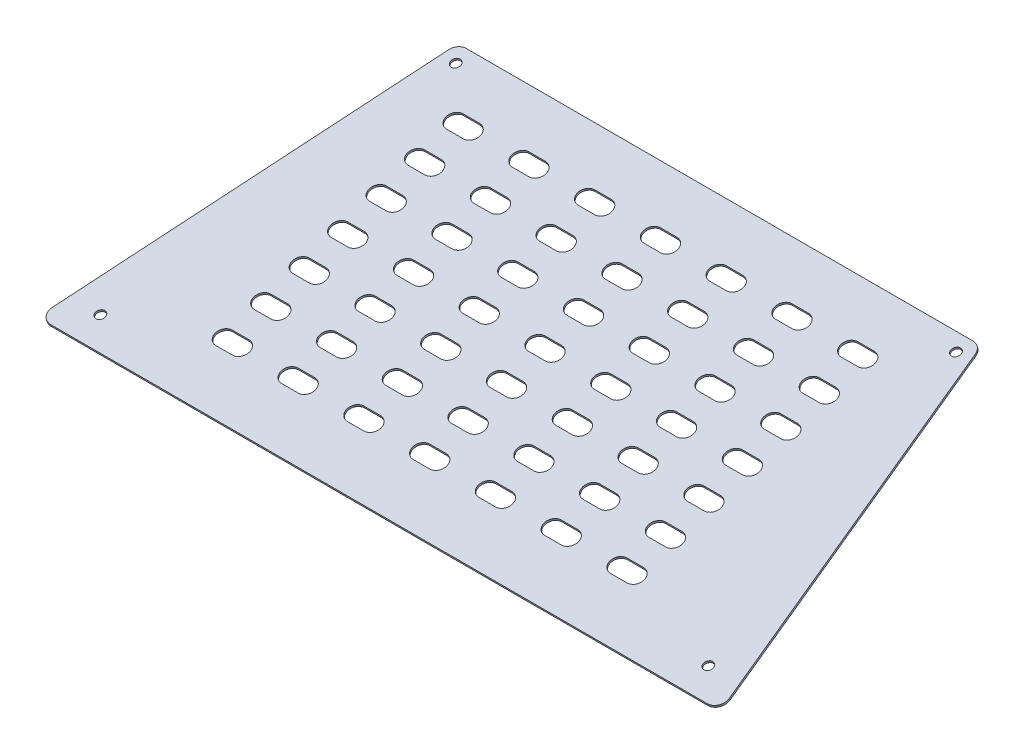
from build123d import *

# Parameters (mm, degrees)
BOSS_EXTRUDE1_START = 1
SKETCH2_R           = 2.25
BOSS_EXTRUDE1_DEPTH = 1
CUT_EXTRUDE1_DEPTH  = 1


with BuildPart() as part:
    # Sketch2 → Boss-Extrude1 (new body)
    with BuildSketch(Plane(origin=(0, 394.173712529, 122.85933897), x_dir=(1, 0, 0), z_dir=(0, 0.954700334487347, 0.2975689354246304)).offset(BOSS_EXTRUDE1_START)):
        with BuildLine():
            Line((-128.178393634, 873.415697526), (-164.692944748, 709.781747011))
            ThreePointArc((-164.692944748, 709.781747011), (-163.71455594, 705.565874018), (-159.812967812, 703.692791042))
            Line((-159.812967812, 703.692791042), (159.812967812, 703.692791042))
            ThreePointArc((159.812967812, 703.692791042), (163.71455594, 705.565874018), (164.692944748, 709.781747011))
            Line((164.692944748, 709.781747011), (128.178393634, 873.415697526))
            ThreePointArc((128.178393634, 873.415697526), (126.425333722, 876.228329685), (123.298416698, 877.326741556))
            Line((123.298416698, 877.326741556), (-123.298416698, 877.326741556))
            ThreePointArc((-123.298416698, 877.326741556), (-126.425333722, 876.228329685), (-128.178393634, 873.415697526))
        make_face()
        with Locations(Location((-121.695522225, 870.326741556, 0), (0, 0, 90))):
            Circle(SKETCH2_R, mode=Mode.SUBTRACT)
        with Locations(Location((121.695522225, 870.326741556, 0), (0, 0, 90))):
            Circle(SKETCH2_R, mode=Mode.SUBTRACT)
        with Locations(Location((147.891037223, 716.692791042, 0), (0, 0, 90))):
            Circle(SKETCH2_R, mode=Mode.SUBTRACT)
        with Locations(Location((-147.891037223, 716.692791042, 0), (0, 0, 90))):
            Circle(SKETCH2_R, mode=Mode.SUBTRACT)
    extrude(amount=BOSS_EXTRUDE1_DEPTH)

    # Sketch3 → Cut-Extrude1 (cut)
    with BuildSketch(Plane(origin=(0, 396.083113198, 123.454476841), x_dir=(1, 0, 0), z_dir=(0, 0.954700334487347, 0.2975689354246304))):
        with BuildLine():
            Line((-103.188534798, 854.726741556), (-95.188534798, 854.726741556))
            ThreePointArc((-95.188534798, 854.726741556), (-90.988534798, 850.526741556), (-95.188534798, 846.326741556))
            Line((-95.188534798, 846.326741556), (-103.188534798, 846.326741556))
            ThreePointArc((-103.188534798, 846.326741556), (-107.388534798, 850.526741556), (-103.188534798, 854.726741556))
        make_face()
        with BuildLine():
            Line((-71.188534798, 854.726741556), (-63.188534798, 854.726741556))
            ThreePointArc((-63.188534798, 854.726741556), (-58.988534798, 850.526741556), (-63.188534798, 846.326741556))
            Line((-63.188534798, 846.326741556), (-71.188534798, 846.326741556))
            ThreePointArc((-71.188534798, 846.326741556), (-75.388534798, 850.526741556), (-71.188534798, 854.726741556))
        make_face()
        with BuildLine():
            Line((-39.188534798, 854.726741556), (-31.188534798, 854.726741556))
            ThreePointArc((-31.188534798, 854.726741556), (-26.988534798, 850.526741556), (-31.188534798, 846.326741556))
            Line((-31.188534798, 846.326741556), (-39.188534798, 846.326741556))
            ThreePointArc((-39.188534798, 846.326741556), (-43.388534798, 850.526741556), (-39.188534798, 854.726741556))
        make_face()
        with BuildLine():
            Line((-7.188534798, 854.726741556), (0.811465202, 854.726741556))
            ThreePointArc((0.811465202, 854.726741556), (5.011465202, 850.526741556), (0.811465202, 846.326741556))
            Line((0.811465202, 846.326741556), (-7.188534798, 846.326741556))
            ThreePointArc((-7.188534798, 846.326741556), (-11.388534798, 850.526741556), (-7.188534798, 854.726741556))
        make_face()
        with BuildLine():
            Line((24.811465202, 854.726741556), (32.811465202, 854.726741556))
            ThreePointArc((32.811465202, 854.726741556), (37.011465202, 850.526741556), (32.811465202, 846.326741556))
            Line((32.811465202, 846.326741556), (24.811465202, 846.326741556))
            ThreePointArc((24.811465202, 846.326741556), (20.611465202, 850.526741556), (24.811465202, 854.726741556))
        make_face()
        with BuildLine():
            Line((56.811465202, 854.726741556), (64.811465202, 854.726741556))
            ThreePointArc((64.811465202, 854.726741556), (69.011465202, 850.526741556), (64.811465202, 846.326741556))
            Line((64.811465202, 846.326741556), (56.811465202, 846.326741556))
            ThreePointArc((56.811465202, 846.326741556), (52.611465202, 850.526741556), (56.811465202, 854.726741556))
        make_face()
        with BuildLine():
            Line((88.811465202, 854.726741556), (96.811465202, 854.726741556))
            ThreePointArc((96.811465202, 854.726741556), (101.011465202, 850.526741556), (96.811465202, 846.326741556))
            Line((96.811465202, 846.326741556), (88.811465202, 846.326741556))
            ThreePointArc((88.811465202, 846.326741556), (84.611465202, 850.526741556), (88.811465202, 854.726741556))
        make_face()
        with BuildLine():
            Line((-71.188534798, 835.126741556), (-63.188534798, 835.126741556))
            ThreePointArc((-63.188534798, 835.126741556), (-58.988534798, 830.926741556), (-63.188534798, 826.726741556))
            Line((-63.188534798, 826.726741556), (-71.188534798, 826.726741556))
            ThreePointArc((-71.188534798, 826.726741556), (-75.388534798, 830.926741556), (-71.188534798, 835.126741556))
        make_face()
        with BuildLine():
            Line((-39.188534798, 835.126741556), (-31.188534798, 835.126741556))
            ThreePointArc((-31.188534798, 835.126741556), (-26.988534798, 830.926741556), (-31.188534798, 826.726741556))
            Line((-31.188534798, 826.726741556), (-39.188534798, 826.726741556))
            ThreePointArc((-39.188534798, 826.726741556), (-43.388534798, 830.926741556), (-39.188534798, 835.126741556))
        make_face()
        with BuildLine():
            Line((-7.188534798, 835.126741556), (0.811465202, 835.126741556))
            ThreePointArc((0.811465202, 835.126741556), (5.011465202, 830.926741556), (0.811465202, 826.726741556))
            Line((0.811465202, 826.726741556), (-7.188534798, 826.726741556))
            ThreePointArc((-7.188534798, 826.726741556), (-11.388534798, 830.926741556), (-7.188534798, 835.126741556))
        make_face()
        with BuildLine():
            Line((24.811465202, 835.126741556), (32.811465202, 835.126741556))
            ThreePointArc((32.811465202, 835.126741556), (37.011465202, 830.926741556), (32.811465202, 826.726741556))
            Line((32.811465202, 826.726741556), (24.811465202, 826.726741556))
            ThreePointArc((24.811465202, 826.726741556), (20.611465202, 830.926741556), (24.811465202, 835.126741556))
        make_face()
        with BuildLine():
            Line((56.811465202, 835.126741556), (64.811465202, 835.126741556))
            ThreePointArc((64.811465202, 835.126741556), (69.011465202, 830.926741556), (64.811465202, 826.726741556))
            Line((64.811465202, 826.726741556), (56.811465202, 826.726741556))
            ThreePointArc((56.811465202, 826.726741556), (52.611465202, 830.926741556), (56.811465202, 835.126741556))
        make_face()
        with BuildLine():
            Line((88.811465202, 835.126741556), (96.811465202, 835.126741556))
            ThreePointArc((96.811465202, 835.126741556), (101.011465202, 830.926741556), (96.811465202, 826.726741556))
            Line((96.811465202, 826.726741556), (88.811465202, 826.726741556))
            ThreePointArc((88.811465202, 826.726741556), (84.611465202, 830.926741556), (88.811465202, 835.126741556))
        make_face()
        with BuildLine():
            Line((-71.188534798, 815.526741556), (-63.188534798, 815.526741556))
            ThreePointArc((-63.188534798, 815.526741556), (-58.988534798, 811.326741556), (-63.188534798, 807.126741556))
            Line((-63.188534798, 807.126741556), (-71.188534798, 807.126741556))
            ThreePointArc((-71.188534798, 807.126741556), (-75.388534798, 811.326741556), (-71.188534798, 815.526741556))
        make_face()
        with BuildLine():
            Line((-39.188534798, 815.526741556), (-31.188534798, 815.526741556))
            ThreePointArc((-31.188534798, 815.526741556), (-26.988534798, 811.326741556), (-31.188534798, 807.126741556))
            Line((-31.188534798, 807.126741556), (-39.188534798, 807.126741556))
            ThreePointArc((-39.188534798, 807.126741556), (-43.388534798, 811.326741556), (-39.188534798, 815.526741556))
        make_face()
        with BuildLine():
            Line((-7.188534798, 815.526741556), (0.811465202, 815.526741556))
            ThreePointArc((0.811465202, 815.526741556), (5.011465202, 811.326741556), (0.811465202, 807.126741556))
            Line((0.811465202, 807.126741556), (-7.188534798, 807.126741556))
            ThreePointArc((-7.188534798, 807.126741556), (-11.388534798, 811.326741556), (-7.188534798, 815.526741556))
        make_face()
        with BuildLine():
            Line((24.811465202, 815.526741556), (32.811465202, 815.526741556))
            ThreePointArc((32.811465202, 815.526741556), (37.011465202, 811.326741556), (32.811465202, 807.126741556))
            Line((32.811465202, 807.126741556), (24.811465202, 807.126741556))
            ThreePointArc((24.811465202, 807.126741556), (20.611465202, 811.326741556), (24.811465202, 815.526741556))
        make_face()
        with BuildLine():
            Line((56.811465202, 815.526741556), (64.811465202, 815.526741556))
            ThreePointArc((64.811465202, 815.526741556), (69.011465202, 811.326741556), (64.811465202, 807.126741556))
            Line((64.811465202, 807.126741556), (56.811465202, 807.126741556))
            ThreePointArc((56.811465202, 807.126741556), (52.611465202, 811.326741556), (56.811465202, 815.526741556))
        make_face()
        with BuildLine():
            Line((88.811465202, 815.526741556), (96.811465202, 815.526741556))
            ThreePointArc((96.811465202, 815.526741556), (101.011465202, 811.326741556), (96.811465202, 807.126741556))
            Line((96.811465202, 807.126741556), (88.811465202, 807.126741556))
            ThreePointArc((88.811465202, 807.126741556), (84.611465202, 811.326741556), (88.811465202, 815.526741556))
        make_face()
        with BuildLine():
            Line((-71.188534798, 795.926741556), (-63.188534798, 795.926741556))
            ThreePointArc((-63.188534798, 795.926741556), (-58.988534798, 791.726741556), (-63.188534798, 787.526741556))
            Line((-63.188534798, 787.526741556), (-71.188534798, 787.526741556))
            ThreePointArc((-71.188534798, 787.526741556), (-75.388534798, 791.726741556), (-71.188534798, 795.926741556))
        make_face()
        with BuildLine():
            Line((-39.188534798, 795.926741556), (-31.188534798, 795.926741556))
            ThreePointArc((-31.188534798, 795.926741556), (-26.988534798, 791.726741556), (-31.188534798, 787.526741556))
            Line((-31.188534798, 787.526741556), (-39.188534798, 787.526741556))
            ThreePointArc((-39.188534798, 787.526741556), (-43.388534798, 791.726741556), (-39.188534798, 795.926741556))
        make_face()
        with BuildLine():
            Line((-7.188534798, 795.926741556), (0.811465202, 795.926741556))
            ThreePointArc((0.811465202, 795.926741556), (5.011465202, 791.726741556), (0.811465202, 787.526741556))
            Line((0.811465202, 787.526741556), (-7.188534798, 787.526741556))
            ThreePointArc((-7.188534798, 787.526741556), (-11.388534798, 791.726741556), (-7.188534798, 795.926741556))
        make_face()
        with BuildLine():
            Line((24.811465202, 795.926741556), (32.811465202, 795.926741556))
            ThreePointArc((32.811465202, 795.926741556), (37.011465202, 791.726741556), (32.811465202, 787.526741556))
            Line((32.811465202, 787.526741556), (24.811465202, 787.526741556))
            ThreePointArc((24.811465202, 787.526741556), (20.611465202, 791.726741556), (24.811465202, 795.926741556))
        make_face()
        with BuildLine():
            Line((56.811465202, 795.926741556), (64.811465202, 795.926741556))
            ThreePointArc((64.811465202, 795.926741556), (69.011465202, 791.726741556), (64.811465202, 787.526741556))
            Line((64.811465202, 787.526741556), (56.811465202, 787.526741556))
            ThreePointArc((56.811465202, 787.526741556), (52.611465202, 791.726741556), (56.811465202, 795.926741556))
        make_face()
        with BuildLine():
            Line((88.811465202, 795.926741556), (96.811465202, 795.926741556))
            ThreePointArc((96.811465202, 795.926741556), (101.011465202, 791.726741556), (96.811465202, 787.526741556))
            Line((96.811465202, 787.526741556), (88.811465202, 787.526741556))
            ThreePointArc((88.811465202, 787.526741556), (84.611465202, 791.726741556), (88.811465202, 795.926741556))
        make_face()
        with BuildLine():
            Line((-71.188534798, 776.326741556), (-63.188534798, 776.326741556))
            ThreePointArc((-63.188534798, 776.326741556), (-58.988534798, 772.126741556), (-63.188534798, 767.926741556))
            Line((-63.188534798, 767.926741556), (-71.188534798, 767.926741556))
            ThreePointArc((-71.188534798, 767.926741556), (-75.388534798, 772.126741556), (-71.188534798, 776.326741556))
        make_face()
        with BuildLine():
            Line((-39.188534798, 776.326741556), (-31.188534798, 776.326741556))
            ThreePointArc((-31.188534798, 776.326741556), (-26.988534798, 772.126741556), (-31.188534798, 767.926741556))
            Line((-31.188534798, 767.926741556), (-39.188534798, 767.926741556))
            ThreePointArc((-39.188534798, 767.926741556), (-43.388534798, 772.126741556), (-39.188534798, 776.326741556))
        make_face()
        with BuildLine():
            Line((-7.188534798, 776.326741556), (0.811465202, 776.326741556))
            ThreePointArc((0.811465202, 776.326741556), (5.011465202, 772.126741556), (0.811465202, 767.926741556))
            Line((0.811465202, 767.926741556), (-7.188534798, 767.926741556))
            ThreePointArc((-7.188534798, 767.926741556), (-11.388534798, 772.126741556), (-7.188534798, 776.326741556))
        make_face()
        with BuildLine():
            Line((24.811465202, 776.326741556), (32.811465202, 776.326741556))
            ThreePointArc((32.811465202, 776.326741556), (37.011465202, 772.126741556), (32.811465202, 767.926741556))
            Line((32.811465202, 767.926741556), (24.811465202, 767.926741556))
            ThreePointArc((24.811465202, 767.926741556), (20.611465202, 772.126741556), (24.811465202, 776.326741556))
        make_face()
        with BuildLine():
            Line((56.811465202, 776.326741556), (64.811465202, 776.326741556))
            ThreePointArc((64.811465202, 776.326741556), (69.011465202, 772.126741556), (64.811465202, 767.926741556))
            Line((64.811465202, 767.926741556), (56.811465202, 767.926741556))
            ThreePointArc((56.811465202, 767.926741556), (52.611465202, 772.126741556), (56.811465202, 776.326741556))
        make_face()
        with BuildLine():
            Line((88.811465202, 776.326741556), (96.811465202, 776.326741556))
            ThreePointArc((96.811465202, 776.326741556), (101.011465202, 772.126741556), (96.811465202, 767.926741556))
            Line((96.811465202, 767.926741556), (88.811465202, 767.926741556))
            ThreePointArc((88.811465202, 767.926741556), (84.611465202, 772.126741556), (88.811465202, 776.326741556))
        make_face()
        with BuildLine():
            Line((-71.188534798, 756.726741556), (-63.188534798, 756.726741556))
            ThreePointArc((-63.188534798, 756.726741556), (-58.988534798, 752.526741556), (-63.188534798, 748.326741556))
            Line((-63.188534798, 748.326741556), (-71.188534798, 748.326741556))
            ThreePointArc((-71.188534798, 748.326741556), (-75.388534798, 752.526741556), (-71.188534798, 756.726741556))
        make_face()
        with BuildLine():
            Line((-39.188534798, 756.726741556), (-31.188534798, 756.726741556))
            ThreePointArc((-31.188534798, 756.726741556), (-26.988534798, 752.526741556), (-31.188534798, 748.326741556))
            Line((-31.188534798, 748.326741556), (-39.188534798, 748.326741556))
            ThreePointArc((-39.188534798, 748.326741556), (-43.388534798, 752.526741556), (-39.188534798, 756.726741556))
        make_face()
        with BuildLine():
            Line((-7.188534798, 756.726741556), (0.811465202, 756.726741556))
            ThreePointArc((0.811465202, 756.726741556), (5.011465202, 752.526741556), (0.811465202, 748.326741556))
            Line((0.811465202, 748.326741556), (-7.188534798, 748.326741556))
            ThreePointArc((-7.188534798, 748.326741556), (-11.388534798, 752.526741556), (-7.188534798, 756.726741556))
        make_face()
        with BuildLine():
            Line((24.811465202, 756.726741556), (32.811465202, 756.726741556))
            ThreePointArc((32.811465202, 756.726741556), (37.011465202, 752.526741556), (32.811465202, 748.326741556))
            Line((32.811465202, 748.326741556), (24.811465202, 748.326741556))
            ThreePointArc((24.811465202, 748.326741556), (20.611465202, 752.526741556), (24.811465202, 756.726741556))
        make_face()
        with BuildLine():
            Line((56.811465202, 756.726741556), (64.811465202, 756.726741556))
            ThreePointArc((64.811465202, 756.726741556), (69.011465202, 752.526741556), (64.811465202, 748.326741556))
            Line((64.811465202, 748.326741556), (56.811465202, 748.326741556))
            ThreePointArc((56.811465202, 748.326741556), (52.611465202, 752.526741556), (56.811465202, 756.726741556))
        make_face()
        with BuildLine():
            Line((88.811465202, 756.726741556), (96.811465202, 756.726741556))
            ThreePointArc((96.811465202, 756.726741556), (101.011465202, 752.526741556), (96.811465202, 748.326741556))
            Line((96.811465202, 748.326741556), (88.811465202, 748.326741556))
            ThreePointArc((88.811465202, 748.326741556), (84.611465202, 752.526741556), (88.811465202, 756.726741556))
        make_face()
        with BuildLine():
            Line((-71.188534798, 737.126741556), (-63.188534798, 737.126741556))
            ThreePointArc((-63.188534798, 737.126741556), (-58.988534798, 732.926741556), (-63.188534798, 728.726741556))
            Line((-63.188534798, 728.726741556), (-71.188534798, 728.726741556))
            ThreePointArc((-71.188534798, 728.726741556), (-75.388534798, 732.926741556), (-71.188534798, 737.126741556))
        make_face()
        with BuildLine():
            Line((-39.188534798, 737.126741556), (-31.188534798, 737.126741556))
            ThreePointArc((-31.188534798, 737.126741556), (-26.988534798, 732.926741556), (-31.188534798, 728.726741556))
            Line((-31.188534798, 728.726741556), (-39.188534798, 728.726741556))
            ThreePointArc((-39.188534798, 728.726741556), (-43.388534798, 732.926741556), (-39.188534798, 737.126741556))
        make_face()
        with BuildLine():
            Line((-7.188534798, 737.126741556), (0.811465202, 737.126741556))
            ThreePointArc((0.811465202, 737.126741556), (5.011465202, 732.926741556), (0.811465202, 728.726741556))
            Line((0.811465202, 728.726741556), (-7.188534798, 728.726741556))
            ThreePointArc((-7.188534798, 728.726741556), (-11.388534798, 732.926741556), (-7.188534798, 737.126741556))
        make_face()
        with BuildLine():
            Line((24.811465202, 737.126741556), (32.811465202, 737.126741556))
            ThreePointArc((32.811465202, 737.126741556), (37.011465202, 732.926741556), (32.811465202, 728.726741556))
            Line((32.811465202, 728.726741556), (24.811465202, 728.726741556))
            ThreePointArc((24.811465202, 728.726741556), (20.611465202, 732.926741556), (24.811465202, 737.126741556))
        make_face()
        with BuildLine():
            Line((56.811465202, 737.126741556), (64.811465202, 737.126741556))
            ThreePointArc((64.811465202, 737.126741556), (69.011465202, 732.926741556), (64.811465202, 728.726741556))
            Line((64.811465202, 728.726741556), (56.811465202, 728.726741556))
            ThreePointArc((56.811465202, 728.726741556), (52.611465202, 732.926741556), (56.811465202, 737.126741556))
        make_face()
        with BuildLine():
            Line((88.811465202, 737.126741556), (96.811465202, 737.126741556))
            ThreePointArc((96.811465202, 737.126741556), (101.011465202, 732.926741556), (96.811465202, 728.726741556))
            Line((96.811465202, 728.726741556), (88.811465202, 728.726741556))
            ThreePointArc((88.811465202, 728.726741556), (84.611465202, 732.926741556), (88.811465202, 737.126741556))
        make_face()
        with BuildLine():
            Line((-103.188534798, 835.126741556), (-95.188534798, 835.126741556))
            ThreePointArc((-95.188534798, 835.126741556), (-90.988534798, 830.926741556), (-95.188534798, 826.726741556))
            Line((-95.188534798, 826.726741556), (-103.188534798, 826.726741556))
            ThreePointArc((-103.188534798, 826.726741556), (-107.388534798, 830.926741556), (-103.188534798, 835.126741556))
        make_face()
        with BuildLine():
            Line((-103.188534798, 815.526741556), (-95.188534798, 815.526741556))
            ThreePointArc((-95.188534798, 815.526741556), (-90.988534798, 811.326741556), (-95.188534798, 807.126741556))
            Line((-95.188534798, 807.126741556), (-103.188534798, 807.126741556))
            ThreePointArc((-103.188534798, 807.126741556), (-107.388534798, 811.326741556), (-103.188534798, 815.526741556))
        make_face()
        with BuildLine():
            Line((-103.188534798, 795.926741556), (-95.188534798, 795.926741556))
            ThreePointArc((-95.188534798, 795.926741556), (-90.988534798, 791.726741556), (-95.188534798, 787.526741556))
            Line((-95.188534798, 787.526741556), (-103.188534798, 787.526741556))
            ThreePointArc((-103.188534798, 787.526741556), (-107.388534798, 791.726741556), (-103.188534798, 795.926741556))
        make_face()
        with BuildLine():
            Line((-103.188534798, 776.326741556), (-95.188534798, 776.326741556))
            ThreePointArc((-95.188534798, 776.326741556), (-90.988534798, 772.126741556), (-95.188534798, 767.926741556))
            Line((-95.188534798, 767.926741556), (-103.188534798, 767.926741556))
            ThreePointArc((-103.188534798, 767.926741556), (-107.388534798, 772.126741556), (-103.188534798, 776.326741556))
        make_face()
        with BuildLine():
            Line((-103.188534798, 756.726741556), (-95.188534798, 756.726741556))
            ThreePointArc((-95.188534798, 756.726741556), (-90.988534798, 752.526741556), (-95.188534798, 748.326741556))
            Line((-95.188534798, 748.326741556), (-103.188534798, 748.326741556))
            ThreePointArc((-103.188534798, 748.326741556), (-107.388534798, 752.526741556), (-103.188534798, 756.726741556))
        make_face()
        with BuildLine():
            Line((-103.188534798, 737.126741556), (-95.188534798, 737.126741556))
            ThreePointArc((-95.188534798, 737.126741556), (-90.988534798, 732.926741556), (-95.188534798, 728.726741556))
            Line((-95.188534798, 728.726741556), (-103.188534798, 728.726741556))
            ThreePointArc((-103.188534798, 728.726741556), (-107.388534798, 732.926741556), (-103.188534798, 737.126741556))
        make_face()
    extrude(amount=-CUT_EXTRUDE1_DEPTH, mode=Mode.SUBTRACT)


solid = part.part
